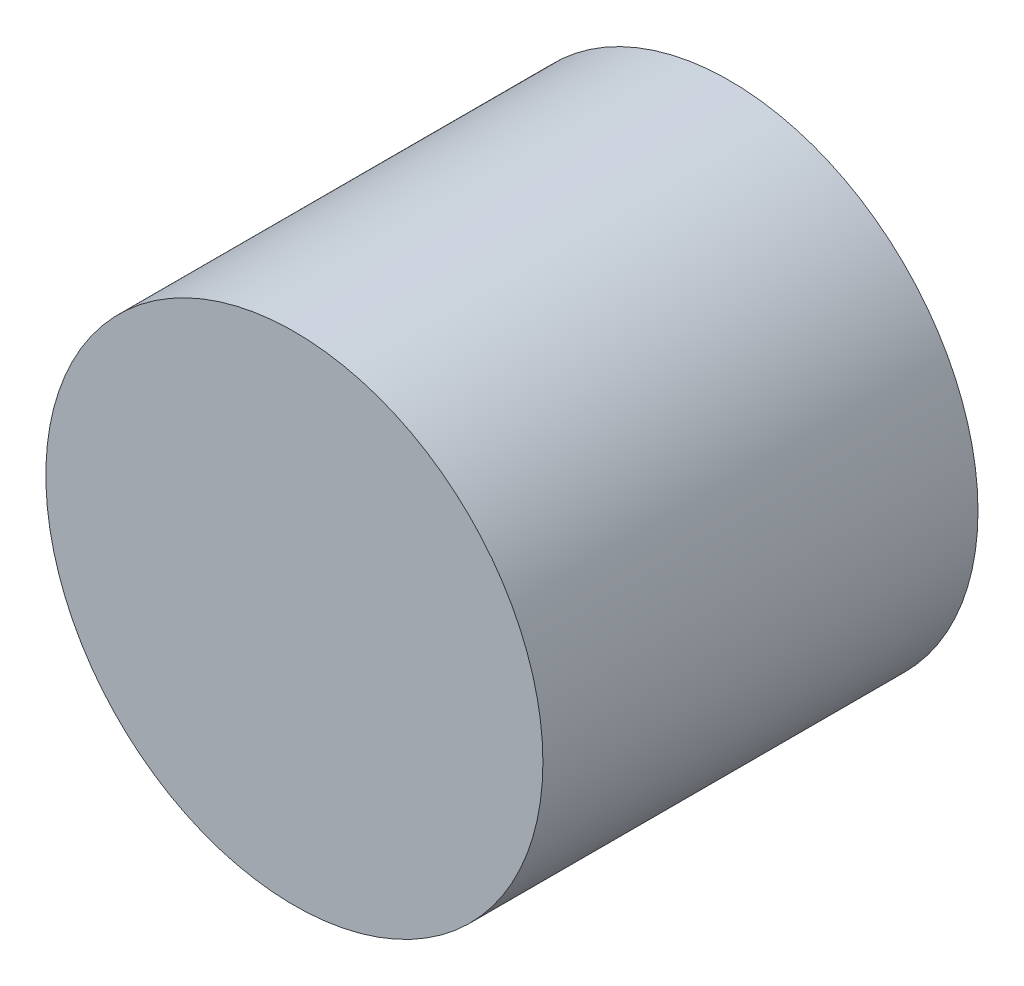
from build123d import *

# Parameters (mm, degrees)
SKETCH1_R      = 7.98
EXTRUDE1_DEPTH = 13.97


with BuildPart() as part:
    # Sketch1 → Extrude1 (new body)
    with BuildSketch(Plane.XY):
        Circle(SKETCH1_R)
    extrude(amount=EXTRUDE1_DEPTH)


solid = part.part
